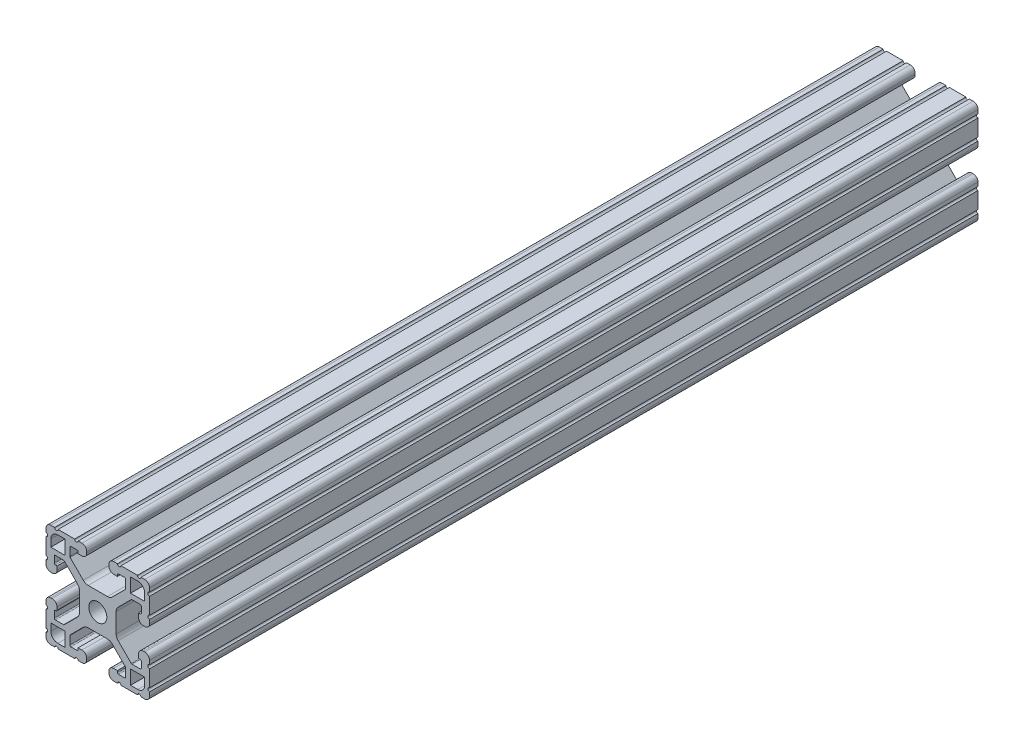
from build123d import *

# Parameters (mm, degrees)
BOSS_EXTRUDE1_DEPTH      = 152.4
BOSS_EXTRUDE1_DEPTH_BACK = 152.4
SKETCH3_W                = 38.1
SKETCH3_H                = 38.1
SKETCH4_W                = 5.207
SKETCH4_H                = 5.207
SKETCH4_R                = 3.3274
CUT_EXTRUDE1_DEPTH       = 306.9883086
CUT_EXTRUDE2_DEPTH       = 306.9883086
FILLET1_R                = 2.54
FILLET2_R                = 1.778
FILLET3_R                = 0.396875


with BuildPart() as part:
    # Sketch3 → Boss-Extrude1 (new, two sides: drawn at the far end of the back side and taken through both)
    with BuildSketch(Plane.XY.offset(-BOSS_EXTRUDE1_DEPTH_BACK)):
        Rectangle(SKETCH3_W, SKETCH3_H)
    extrude(amount=BOSS_EXTRUDE1_DEPTH + BOSS_EXTRUDE1_DEPTH_BACK)

    # Sketch4 → Cut-Extrude1 (cut, through all)
    with BuildSketch(Plane.XY.offset(152.4)):
        Polygon((7.239, 14.986), (4.064, 14.986), (4.064, 19.05), (-4.064, 19.05), (-4.064, 14.986), (-7.239, 14.986), (-7.239, 16.002), (-10.287, 16.002), (-10.287, 12.442261469), (-4.601138531, 6.7564), (4.601138531, 6.7564), (10.287, 12.442261469), (10.287, 16.002), (7.239, 16.002), align=None)
        Polygon((10.287, -12.442261469), (4.601138531, -6.7564), (-4.601138531, -6.7564), (-10.287, -12.442261469), (-10.287, -16.002), (-7.239, -16.002), (-7.239, -14.986), (-4.064, -14.986), (-4.064, -19.05), (4.064, -19.05), (4.064, -14.986), (7.239, -14.986), (7.239, -16.002), (10.287, -16.002), align=None)
        Polygon((-12.442261469, -10.287), (-6.7564, -4.601138531), (-6.7564, 4.601138531), (-12.442261469, 10.287), (-16.002, 10.287), (-16.002, 7.239), (-14.986, 7.239), (-14.986, 4.064), (-19.05, 4.064), (-19.05, -4.064), (-14.986, -4.064), (-14.986, -7.239), (-16.002, -7.239), (-16.002, -10.287), align=None)
        Polygon((14.986, -7.239), (14.986, -4.064), (19.05, -4.064), (19.05, 4.064), (14.986, 4.064), (14.986, 7.239), (16.002, 7.239), (16.002, 10.287), (12.442261469, 10.287), (6.7564, 4.601138531), (6.7564, -4.601138531), (12.442261469, -10.287), (16.002, -10.287), (16.002, -7.239), align=None)
        with Locations((14.6685, 14.6685)):
            Rectangle(SKETCH4_W, SKETCH4_H)
        with Locations((14.6685, -14.6685)):
            Rectangle(SKETCH4_W, SKETCH4_H)
        with Locations((-14.6685, 14.6685)):
            Rectangle(SKETCH4_W, SKETCH4_H)
        with Locations((-14.6685, -14.6685)):
            Rectangle(SKETCH4_W, SKETCH4_H)
        Circle(SKETCH4_R)
    extrude(amount=-CUT_EXTRUDE1_DEPTH, mode=Mode.SUBTRACT)

    # Sketch5 → Cut-Extrude2 (cut, through all)
    with BuildSketch(Plane.XY.offset(152.4)):
        with BuildLine():
            Line((-14.605, 19.05), (-15.875, 19.05))
            ThreePointArc((-15.875, 19.05), (-15.24, 18.415), (-14.605, 19.05))
        make_face()
        with BuildLine():
            Line((-7.239, 19.05), (-8.509, 19.05))
            ThreePointArc((-8.509, 19.05), (-7.874, 18.415), (-7.239, 19.05))
        make_face()
        with BuildLine():
            ThreePointArc((-19.05, 14.605), (-18.415, 15.24), (-19.05, 15.875))
            Line((-19.05, 15.875), (-19.05, 14.605))
        make_face()
        with BuildLine():
            ThreePointArc((-19.05, 7.239), (-18.415, 7.874), (-19.05, 8.509))
            Line((-19.05, 8.509), (-19.05, 7.239))
        make_face()
        with BuildLine():
            ThreePointArc((7.239, 19.05), (7.874, 18.415), (8.509, 19.05))
            Line((8.509, 19.05), (7.239, 19.05))
        make_face()
        with BuildLine():
            ThreePointArc((14.605, 19.05), (15.24, 18.415), (15.875, 19.05))
            Line((15.875, 19.05), (14.605, 19.05))
        make_face()
        with BuildLine():
            Line((19.05, 14.605), (19.05, 15.875))
            ThreePointArc((19.05, 15.875), (18.415, 15.24), (19.05, 14.605))
        make_face()
        with BuildLine():
            Line((19.05, 7.239), (19.05, 8.509))
            ThreePointArc((19.05, 8.509), (18.415, 7.874), (19.05, 7.239))
        make_face()
        with BuildLine():
            ThreePointArc((19.05, -7.239), (18.415, -7.874), (19.05, -8.509))
            Line((19.05, -8.509), (19.05, -7.239))
        make_face()
        with BuildLine():
            ThreePointArc((19.05, -14.605), (18.415, -15.24), (19.05, -15.875))
            Line((19.05, -15.875), (19.05, -14.605))
        make_face()
        with BuildLine():
            Line((14.605, -19.05), (15.875, -19.05))
            ThreePointArc((15.875, -19.05), (15.24, -18.415), (14.605, -19.05))
        make_face()
        with BuildLine():
            Line((7.239, -19.05), (8.509, -19.05))
            ThreePointArc((8.509, -19.05), (7.874, -18.415), (7.239, -19.05))
        make_face()
        with BuildLine():
            ThreePointArc((-7.239, -19.05), (-7.874, -18.415), (-8.509, -19.05))
            Line((-8.509, -19.05), (-7.239, -19.05))
        make_face()
        with BuildLine():
            ThreePointArc((-14.605, -19.05), (-15.24, -18.415), (-15.875, -19.05))
            Line((-15.875, -19.05), (-14.605, -19.05))
        make_face()
        with BuildLine():
            Line((-19.05, -14.605), (-19.05, -15.875))
            ThreePointArc((-19.05, -15.875), (-18.415, -15.24), (-19.05, -14.605))
        make_face()
        with BuildLine():
            Line((-19.05, -7.239), (-19.05, -8.509))
            ThreePointArc((-19.05, -8.509), (-18.415, -7.874), (-19.05, -7.239))
        make_face()
    extrude(amount=-CUT_EXTRUDE2_DEPTH, mode=Mode.SUBTRACT)

    # Fillet1
    fillet1_edges = [part.edges().sort_by_distance(p)[0] for p in [
        (6.7564, -4.601138531, 0),
        (6.7564, 4.601138531, 0),
        (-17.272, 17.272, 0),
        (-17.272, -17.272, 0),
        (17.272, -17.272, 0),
        (17.272, 17.272, 0),
        (-4.601138531, -6.7564, 0),
        (4.601138531, -6.7564, 0),
        (-6.7564, 4.601138531, 0),
        (-6.7564, -4.601138531, 0),
        (4.601138531, 6.7564, 0),
        (-4.601138531, 6.7564, 0),
    ]]
    fillet(fillet1_edges, radius=FILLET1_R)

    # Fillet2
    fillet2_edges = [part.edges().sort_by_distance(p)[0] for p in [
        (14.986, 4.064, 0),
        (19.05, 4.064, 0),
        (19.05, -4.064, 0),
        (14.986, -4.064, 0),
        (4.064, -14.986, 0),
        (4.064, -19.05, 0),
        (-4.064, -19.05, 0),
        (-4.064, -14.986, 0),
        (-14.986, -4.064, 0),
        (-19.05, -4.064, 0),
        (-19.05, 4.064, 0),
        (-14.986, 4.064, 0),
        (-19.05, 19.05, 0),
        (19.05, 19.05, 0),
        (19.05, -19.05, 0),
        (-19.05, -19.05, 0),
        (-4.064, 14.986, 0),
        (-4.064, 19.05, 0),
        (4.064, 19.05, 0),
        (4.064, 14.986, 0),
    ]]
    fillet(fillet2_edges, radius=FILLET2_R)

    # Fillet3
    fillet3_edges = [part.edges().sort_by_distance(p)[0] for p in [
        (12.442261469, 10.287, 0),
        (16.002, 10.287, 0),
        (16.002, 7.239, 0),
        (16.002, -7.239, 0),
        (16.002, -10.287, 0),
        (12.442261469, -10.287, 0),
        (-7.239, -16.002, 0),
        (-10.287, -16.002, 0),
        (-10.287, -12.442261469, 0),
        (10.287, -12.442261469, 0),
        (10.287, -16.002, 0),
        (7.239, -16.002, 0),
        (-16.002, 7.239, 0),
        (-16.002, 10.287, 0),
        (-12.442261469, 10.287, 0),
        (-12.442261469, -10.287, 0),
        (-16.002, -10.287, 0),
        (-14.986, -7.239, 0),
        (-10.287, 12.442261469, 0),
        (-10.287, 16.002, 0),
        (-7.239, 16.002, 0),
        (7.239, 16.002, 0),
        (10.287, 16.002, 0),
        (10.287, 12.442261469, 0),
    ]]
    fillet(fillet3_edges, radius=FILLET3_R)


solid = part.part
